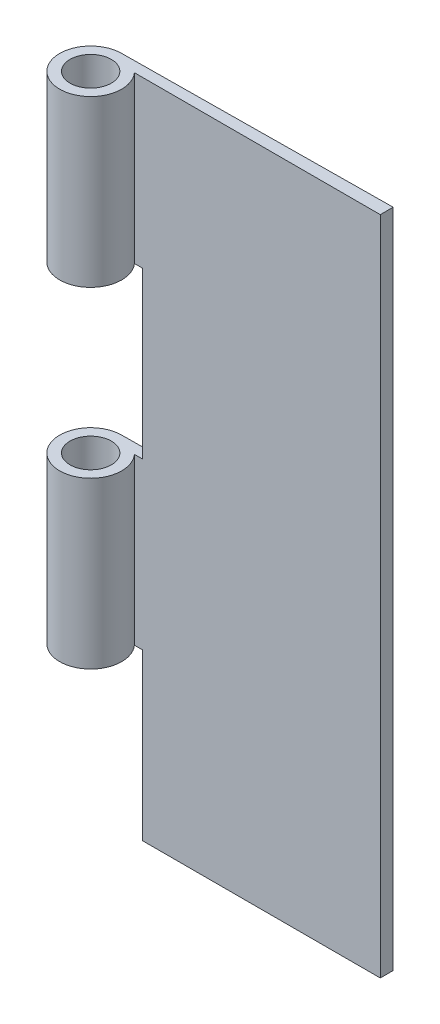
from build123d import *

# Parameters (mm, degrees)
SKETCH1_R               = 7.5
SKETCH1_R_2             = 5
BOSS_EXTRUDE1_DEPTH     = 80
BOSS_EXTRUDE2_DEPTH     = 160
CUT_EXTRUDE1_DEPTH      = 212.272992998
CUT_EXTRUDE1_DEPTH_BACK = 212.272992998


with BuildPart() as part:
    # Sketch1 → Boss-Extrude1 (new, symmetric)
    with BuildSketch(Plane(origin=(0, 0, 0), x_dir=(1, 0, 0), z_dir=(0, 1, 0))):
        with Locations(Location((130.052474297, -2.753634589, 0), (0, 0, 270))):
            Circle(SKETCH1_R)
        with Locations(Location((130.052474297, -2.753634589, 0), (0, 0, 270))):
            Circle(SKETCH1_R_2, mode=Mode.SUBTRACT)
    extrude(amount=BOSS_EXTRUDE1_DEPTH, both=True)

    # Sketch2 → Boss-Extrude2 (add)
    with BuildSketch(Plane(origin=(0, 80, 0), x_dir=(1, 0, 0), z_dir=(0, 1, 0))):
        Polygon((130.052474297, 4.746365411), (195.141045325, 5.361337723), (195.141045325, 2.246365411), (130.052474297, 2.246365411), align=None)
    extrude(amount=-BOSS_EXTRUDE2_DEPTH)

    # Sketch3 → Cut-Extrude1 (cut, two sides: drawn at the far end of the back side and taken through both)
    with BuildSketch(Plane.XY.offset(-2.246365411).offset(-CUT_EXTRUDE1_DEPTH_BACK)):
        Polygon((101.023989242, 40), (137.552474297, 40), (137.552474297, 0), (107.599116552, 0), (107.599116552, -40), (137.552474297, -40), (137.552474297, -90), (101.023989242, -90), align=None)
    extrude(amount=CUT_EXTRUDE1_DEPTH + CUT_EXTRUDE1_DEPTH_BACK, mode=Mode.SUBTRACT)


solid = part.part
